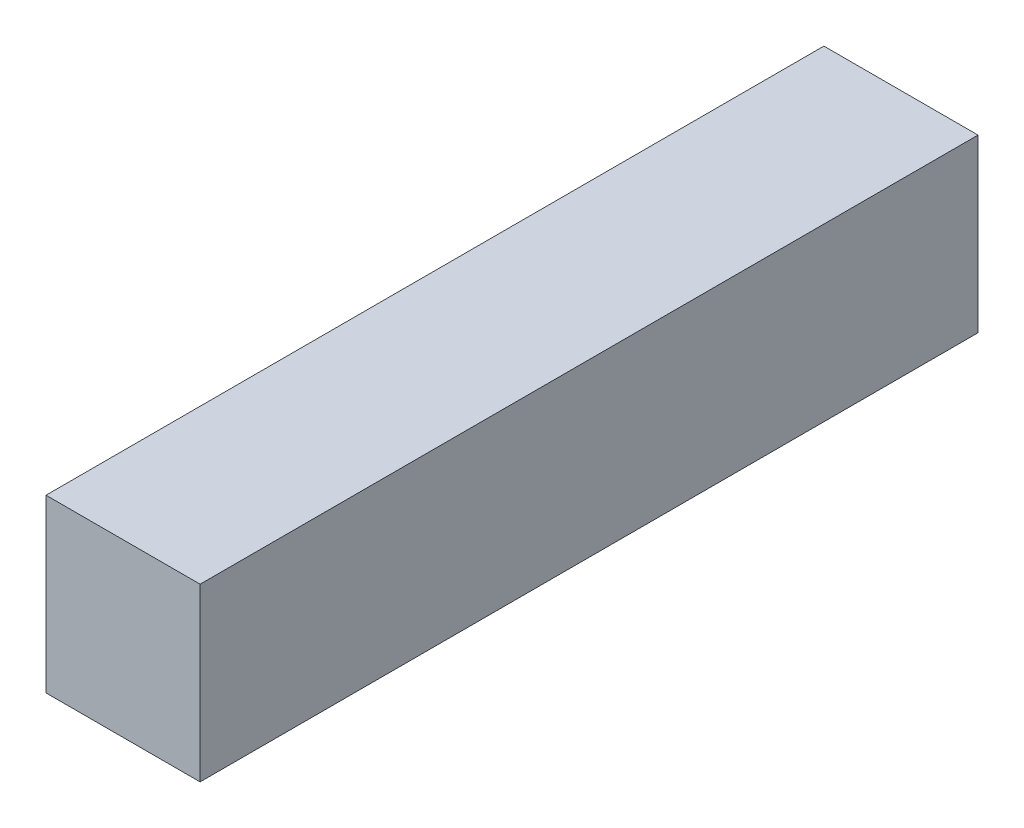
from build123d import *

# Parameters (mm, degrees)
ESQUISSE1_W        = 63
ESQUISSE1_H        = 70
BOSS_EXTRU_1_DEPTH = 318


with BuildPart() as part:
    # Esquisse1 → Boss.-Extru.1 (new body)
    with BuildSketch(Plane.XY):
        with Locations((-31.5, 35)):
            Rectangle(ESQUISSE1_W, ESQUISSE1_H)
    extrude(amount=BOSS_EXTRU_1_DEPTH)


solid = part.part
